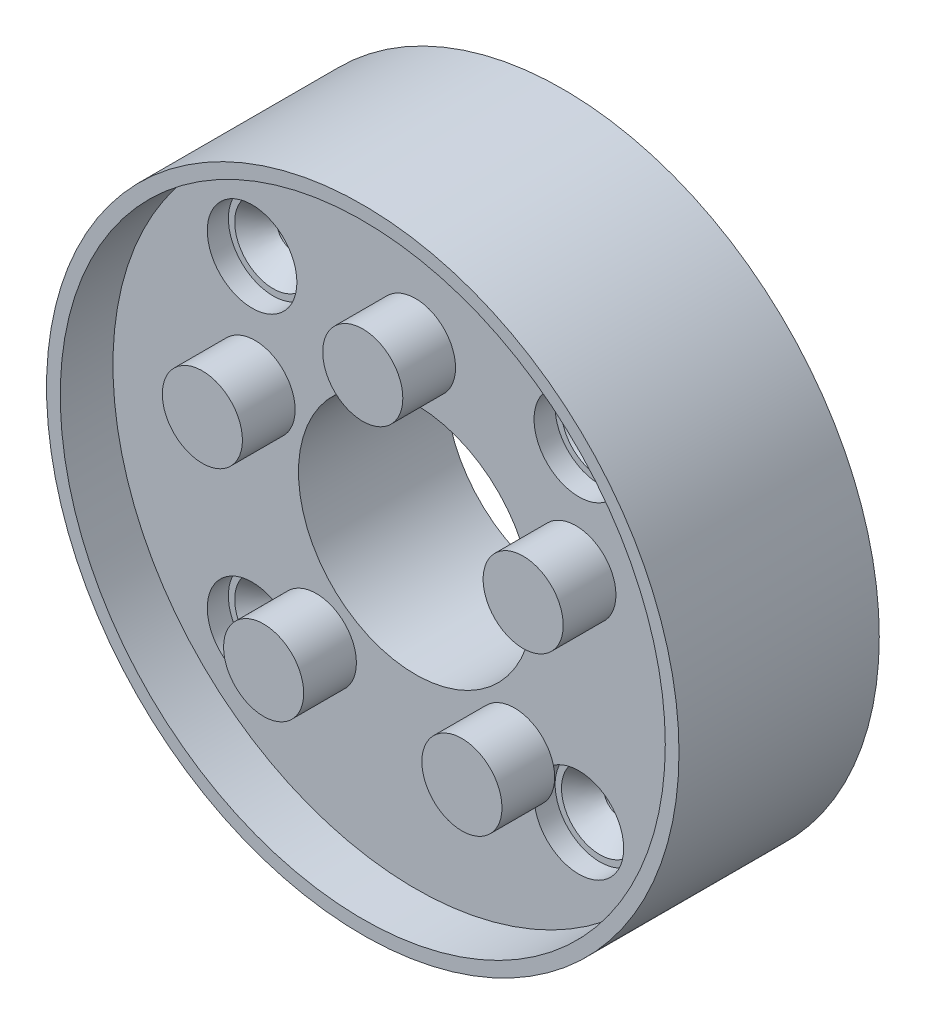
from build123d import *

# Parameters (mm, degrees)
ESQUISSE1_R             = 30
ESQUISSE1_R_2           = 11.1
ESQUISSE1_R_3           = 1.65
BOSS_EXTRU_1_DEPTH      = 14
ESQUISSE3_R             = 30
ESQUISSE3_R_2           = 28.7
ESQUISSE3_R_3           = 3.8
BOSS_EXTRU_2_DEPTH      = 5
ESQUISSE4_R             = 4.25
ENL_V_MAT_EXTRU_1_DEPTH = 2
CHANFREIN1_SIZE         = 2


with BuildPart() as part:
    # Esquisse1 → Boss.-Extru.1 (new body)
    with BuildSketch(Plane.XY):
        Circle(ESQUISSE1_R)
        Circle(ESQUISSE1_R_2, mode=Mode.SUBTRACT)
        with Locations((-15.5, 15.5)):
            Circle(ESQUISSE1_R_3, mode=Mode.SUBTRACT)
        with Locations((15.5, 15.5)):
            Circle(ESQUISSE1_R_3, mode=Mode.SUBTRACT)
        with Locations((15.5, -15.5)):
            Circle(ESQUISSE1_R_3, mode=Mode.SUBTRACT)
        with Locations((-15.5, -15.5)):
            Circle(ESQUISSE1_R_3, mode=Mode.SUBTRACT)
    extrude(amount=BOSS_EXTRU_1_DEPTH)

    # Esquisse3 → Boss.-Extru.2 (add)
    # profile 1 of 6: a face of its own
    with BuildSketch(Plane.XY.offset(14)):
        Circle(ESQUISSE3_R)
        Circle(ESQUISSE3_R_2, mode=Mode.SUBTRACT)
    # profile 2 of 6: a face of its own
    with BuildSketch(Plane.XY.offset(14)):
        with Locations((-15.216904261, 4.94427191)):
            Circle(ESQUISSE3_R_3)
    # profile 3 of 6: a face of its own
    with BuildSketch(Plane.XY.offset(14)):
        with Locations((0, 16)):
            Circle(ESQUISSE3_R_3)
    # profile 4 of 6: a face of its own
    with BuildSketch(Plane.XY.offset(14)):
        with Locations((9.404564037, -12.94427191)):
            Circle(ESQUISSE3_R_3)
    # profile 5 of 6: a face of its own
    with BuildSketch(Plane.XY.offset(14)):
        with Locations((-9.404564037, -12.94427191)):
            Circle(ESQUISSE3_R_3)
    # profile 6 of 6: a face of its own
    with BuildSketch(Plane.XY.offset(14)):
        with Locations((15.216904261, 4.94427191)):
            Circle(ESQUISSE3_R_3)
    extrude(amount=BOSS_EXTRU_2_DEPTH)

    # Esquisse4 → Enlèv. mat.-Extru.1 (cut)
    with BuildSketch(Plane.XY.offset(14)):
        with Locations((-15.5, 15.5)):
            Circle(ESQUISSE4_R)
        with Locations((15.5, 15.5)):
            Circle(ESQUISSE4_R)
        with Locations((15.5, -15.5)):
            Circle(ESQUISSE4_R)
        with Locations((-15.5, -15.5)):
            Circle(ESQUISSE4_R)
    extrude(amount=-ENL_V_MAT_EXTRU_1_DEPTH, mode=Mode.SUBTRACT)

    # Chanfrein1
    chanfrein1_edges = [part.edges().sort_by_distance(p)[0] for p in [
        (-17.15, -15.5, 12),
        (13.85, -15.5, 12),
        (13.85, 15.5, 12),
        (-17.15, 15.5, 12),
    ]]
    chamfer(chanfrein1_edges, length=CHANFREIN1_SIZE)


solid = part.part
